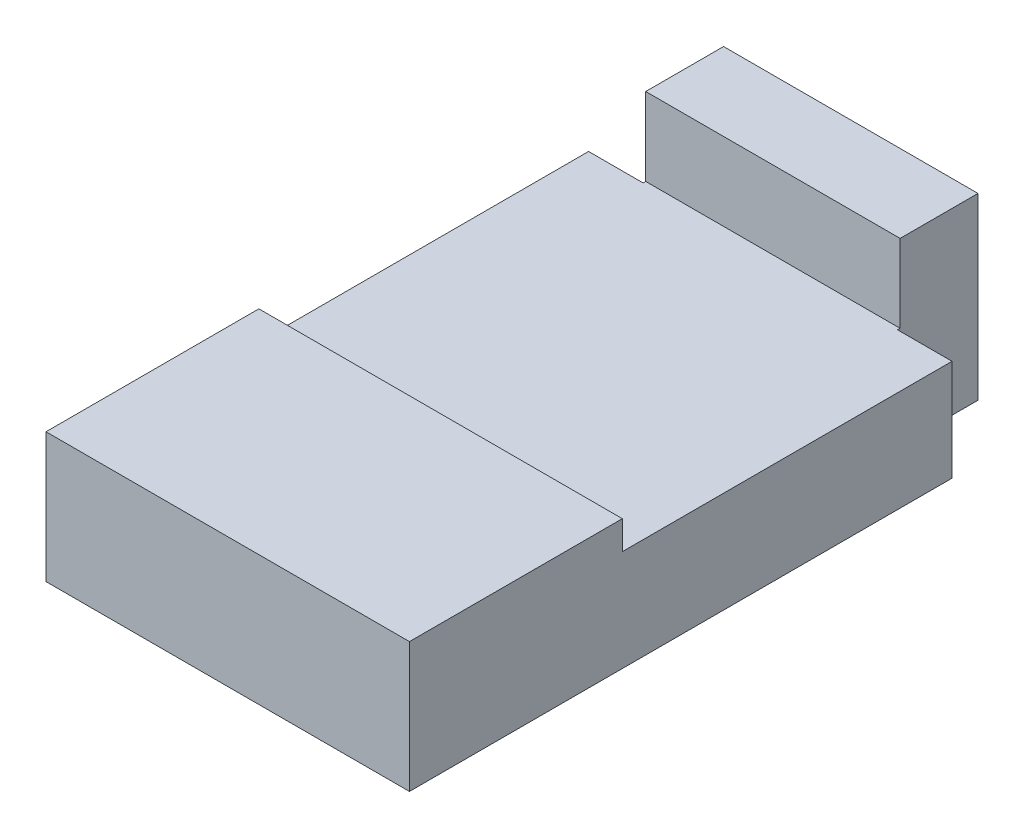
from build123d import *

# Parameters (mm, degrees)
BOSS_EXTRUDE1_DEPTH      = 9
BOSS_EXTRUDE1_DEPTH_BACK = 3
SKETCH1_W                = 4.9
SKETCH1_H                = 1.95
SKETCH2_W                = 4.9
SKETCH2_H                = 1.5
BOSS_EXTRUDE2_DEPTH      = 1.5
SKETCH3_W                = 10.45
SKETCH3_H                = 1.95
BOSS_EXTRUDE3_DEPTH      = 3.5
SKETCH4_W                = 7
SKETCH4_H                = 4.1
BOSS_EXTRUDE4_DEPTH      = 0.55


with BuildPart() as part:
    # Sketch1 → Boss-Extrude1 (new, two sides: drawn at the far end of the back side and taken through both)
    with BuildSketch(Plane.XY.offset(-BOSS_EXTRUDE1_DEPTH_BACK)):
        Rectangle(SKETCH1_W, SKETCH1_H)
    extrude(amount=BOSS_EXTRUDE1_DEPTH + BOSS_EXTRUDE1_DEPTH_BACK)

    # Sketch2 → Boss-Extrude2 (add)
    with BuildSketch(Plane(origin=(0, 0.975, 0), x_dir=(1, 0, 0), z_dir=(0, 1, 0))):
        with Locations((0, 2.25)):
            Rectangle(SKETCH2_W, SKETCH2_H)
    extrude(amount=BOSS_EXTRUDE2_DEPTH)

    # Sketch3 → Boss-Extrude3 (add, symmetric)
    with BuildSketch(Plane(origin=(0, 0, 0), x_dir=(0, 0, -1), z_dir=(1, 0, 0))):
        with Locations((-3.775, 0)):
            Rectangle(SKETCH3_W, SKETCH3_H)
    extrude(amount=BOSS_EXTRUDE3_DEPTH, both=True)

    # Sketch4 → Boss-Extrude4 (add)
    with BuildSketch(Plane(origin=(0, 0.975, 0), x_dir=(1, 0, 0), z_dir=(0, 1, 0))):
        with Locations((0, -6.95)):
            Rectangle(SKETCH4_W, SKETCH4_H)
    extrude(amount=BOSS_EXTRUDE4_DEPTH)


solid = part.part
